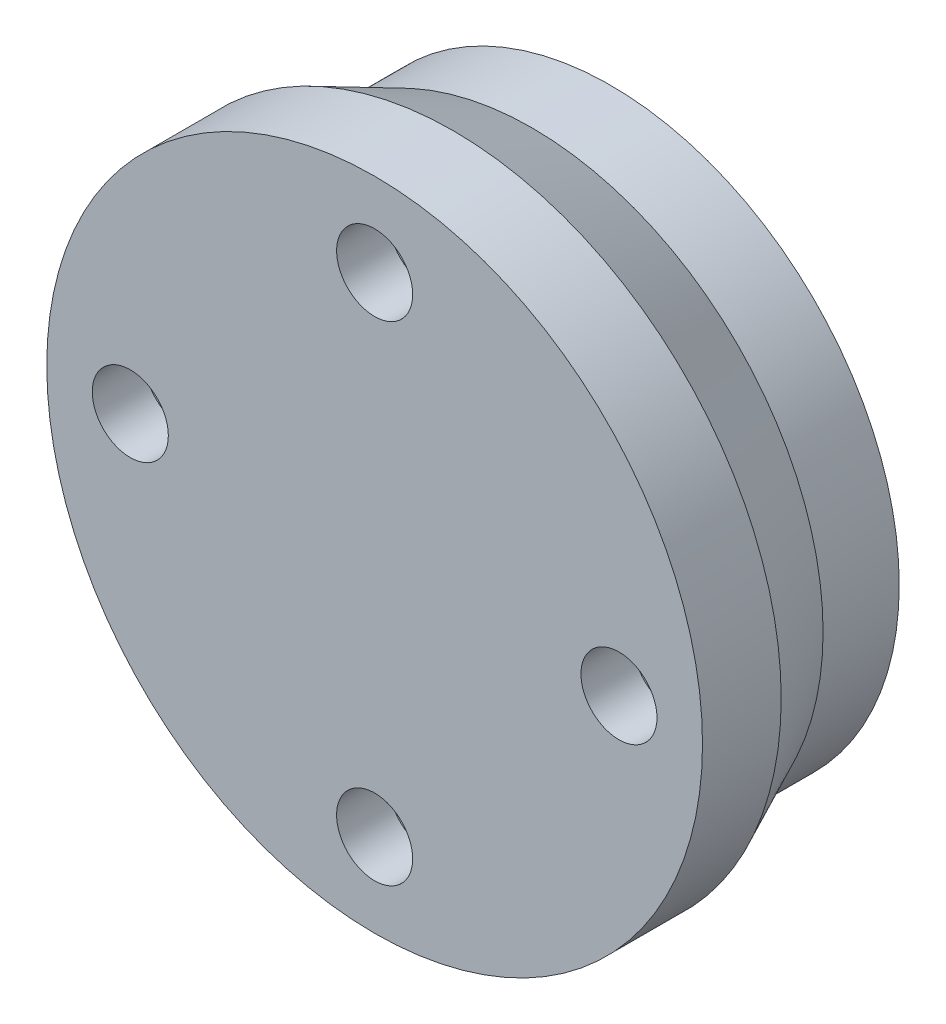
from build123d import *

# Parameters (mm, degrees)
SKETCH1_R           = 11
BOSS_EXTRUDE1_DEPTH = 1.5
SKETCH4_R           = 12.5
BOSS_EXTRUDE2_DEPTH = 3
SKETCH5_R           = 1.45
CUT_EXTRUDE1_DEPTH  = 2
SKETCH6_R           = 1.5
CUT_EXTRUDE2_DEPTH  = 2


with BuildPart() as part:
    # Sketch1 → Boss-Extrude1 (new, symmetric)
    with BuildSketch(Plane.XY):
        Circle(SKETCH1_R)
    extrude(amount=BOSS_EXTRUDE1_DEPTH, both=True)

    # Sketch2 → Revolve1 (revolve)
    with BuildSketch(Plane(origin=(0, 0, 0), x_dir=(0, 0, -1), z_dir=(1, 0, 0)), mode=Mode.PRIVATE) as revolve1_sk:
        Polygon((-4.5, 0), (-4.5, 12.5), (-1.5, 11.096489402), (-1.5, 0), align=None)
    revolve(revolve1_sk.sketch.rotate(Axis((0, 0, 0), (0, 0, 1)), 90), axis=Axis((0, 0, 0), (0, 0, 1)))

    # Sketch4 → Boss-Extrude2 (add)
    with BuildSketch(Plane.XY.offset(4.5)):
        Circle(SKETCH4_R)
    extrude(amount=BOSS_EXTRUDE2_DEPTH)

    # Sketch5 → Cut-Extrude1 (cut)
    with BuildSketch(Plane.XY.offset(7.5)):
        with Locations((0, 9.315)):
            Circle(SKETCH5_R)
        with Locations((9.315, 0)):
            Circle(SKETCH5_R)
        with Locations((0, -9.315)):
            Circle(SKETCH5_R)
        with Locations((-9.315, 0)):
            Circle(SKETCH5_R)
    extrude(amount=-CUT_EXTRUDE1_DEPTH, mode=Mode.SUBTRACT)

    # Sketch6 → Cut-Extrude2 (cut)
    with BuildSketch(Plane(origin=(0, 0, -1.5), x_dir=(-1, 0, 0), z_dir=(0, 0, -1))):
        with Locations((0, 7.5)):
            Circle(SKETCH6_R)
        with Locations((7.5, 0)):
            Circle(SKETCH6_R)
        with Locations((0, -7.5)):
            Circle(SKETCH6_R)
        with Locations((-7.5, 0)):
            Circle(SKETCH6_R)
    extrude(amount=-CUT_EXTRUDE2_DEPTH, mode=Mode.SUBTRACT)


solid = part.part
